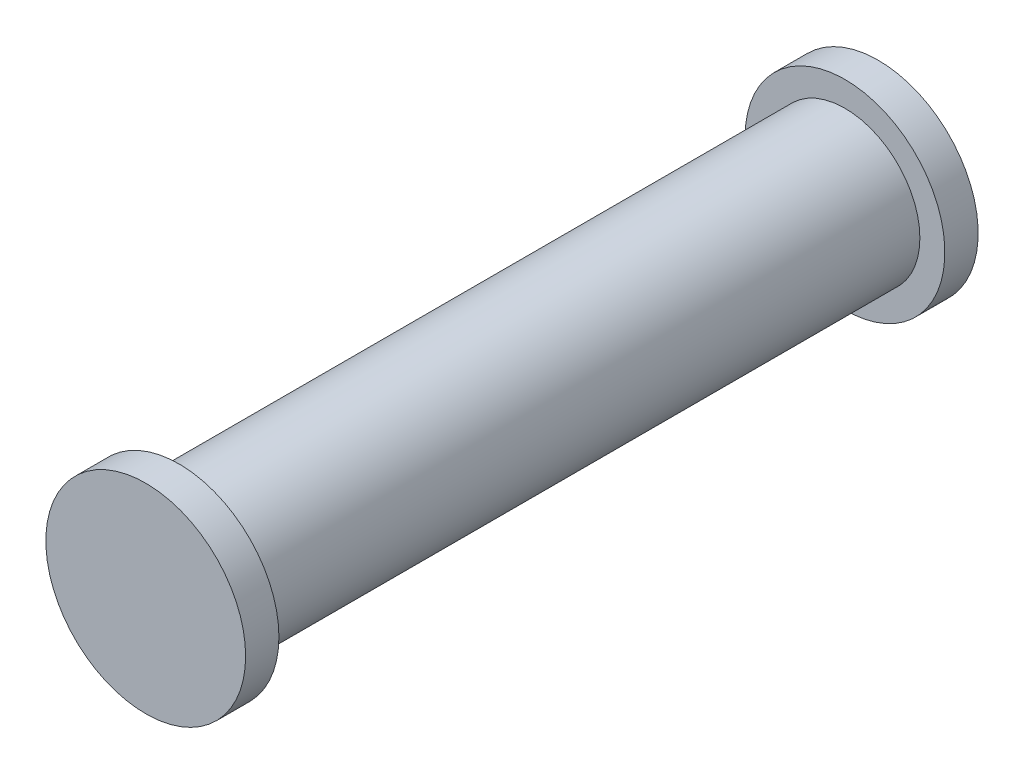
from build123d import *

# Parameters (mm, degrees)
SKIZZE1_R                       = 2.25
AUFSATZ_LINEAR_AUSTRAGEN1_DEPTH = 20
SKIZZE2_R                       = 3
AUFSATZ_LINEAR_AUSTRAGEN2_DEPTH = 1
AUFSATZ_LINEAR_START            = 1
SKIZZE3_R                       = 3
AUFSATZ_LINEAR_AUSTRAGEN3_DEPTH = 1


with BuildPart() as part:
    # Skizze1 → Aufsatz-Linear austragen1 (new body)
    with BuildSketch(Plane.XY):
        with Locations((-14.9, 15.1)):
            Circle(SKIZZE1_R)
    extrude(amount=-AUFSATZ_LINEAR_AUSTRAGEN1_DEPTH)

    # Skizze2 → Aufsatz-Linear austragen2 (add)
    with BuildSketch(Plane.XY):
        with Locations((-14.9, 15.1)):
            Circle(SKIZZE2_R)
    extrude(amount=AUFSATZ_LINEAR_AUSTRAGEN2_DEPTH)

    # Skizze3 → Aufsatz-Linear austragen3 (add)
    with BuildSketch(Plane(origin=(0, 0, -20), x_dir=(-1, 0, 0), z_dir=(0, 0, -1)).offset(AUFSATZ_LINEAR_START)):
        with Locations(Location((14.9, 15.1, 0), (0, 0, 180))):
            Circle(SKIZZE3_R)
    extrude(amount=-AUFSATZ_LINEAR_AUSTRAGEN3_DEPTH)


solid = part.part
